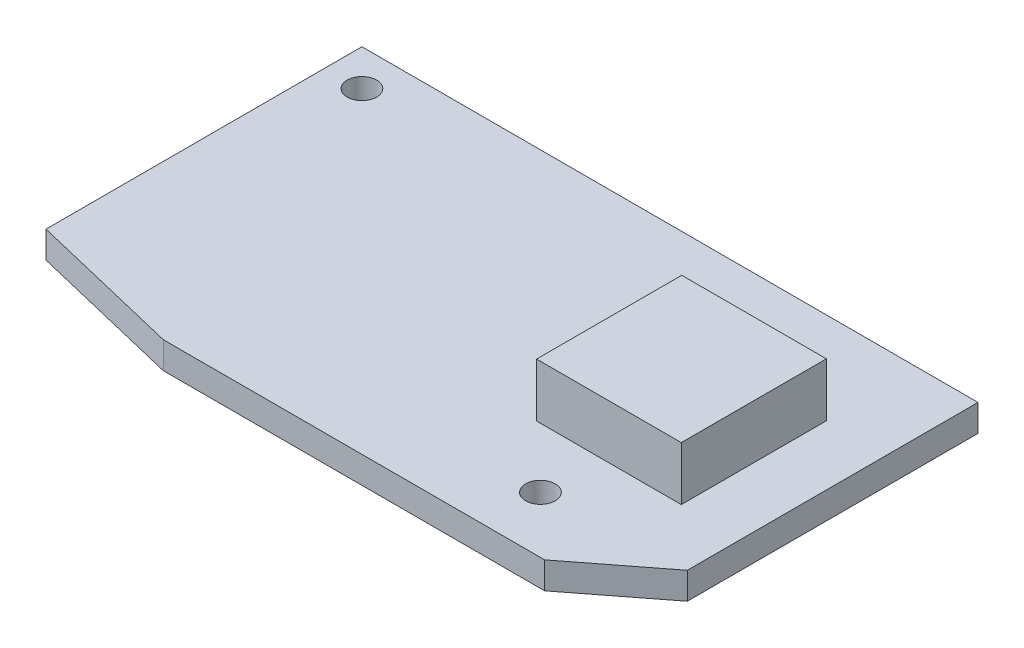
from build123d import *

# Parameters (mm, degrees)
EXTRUDE_2_DEPTH     = 2
SKETCH_2_W          = 10.779016103
SKETCH_2_H          = 10.811001315
EXTRUDE_3_DEPTH     = 4
SKETCH_3_R          = 1.1
CUT_EXTRUDE_1_DEPTH = 4


with BuildPart() as part:
    # 草图1 → 凸台-拉伸2 (new body)
    with BuildSketch(Plane(origin=(0, 0, 0), x_dir=(1, 0, 0), z_dir=(0, 1, 0))):
        Polygon((0, 0), (45.9, 0), (45.9, -21.658695652), (39.913043478, -26.3), (11.504347826, -26.3), (0, -23.536956522), align=None)
    extrude(amount=EXTRUDE_2_DEPTH)

    # 草图2 → 凸台-拉伸3 (add)
    with BuildSketch(Plane(origin=(0, 2, 0), x_dir=(1, 0, 0), z_dir=(0, 1, 0))):
        with Locations((36.047943901, -12.238421487)):
            Rectangle(SKETCH_2_W, SKETCH_2_H)
    extrude(amount=EXTRUDE_3_DEPTH)

    # 草图3 → 切除-拉伸1 (cut)
    with BuildSketch(Plane(origin=(0, 2, 0), x_dir=(1, 0, 0), z_dir=(0, 1, 0))):
        with Locations(Location((2.7, -2.7, 0), (0, 0, 270))):
            Circle(SKETCH_3_R)
        with Locations(Location((35.4, -22.1, 0), (0, 0, 270))):
            Circle(SKETCH_3_R)
    extrude(amount=-CUT_EXTRUDE_1_DEPTH, mode=Mode.SUBTRACT)


solid = part.part
